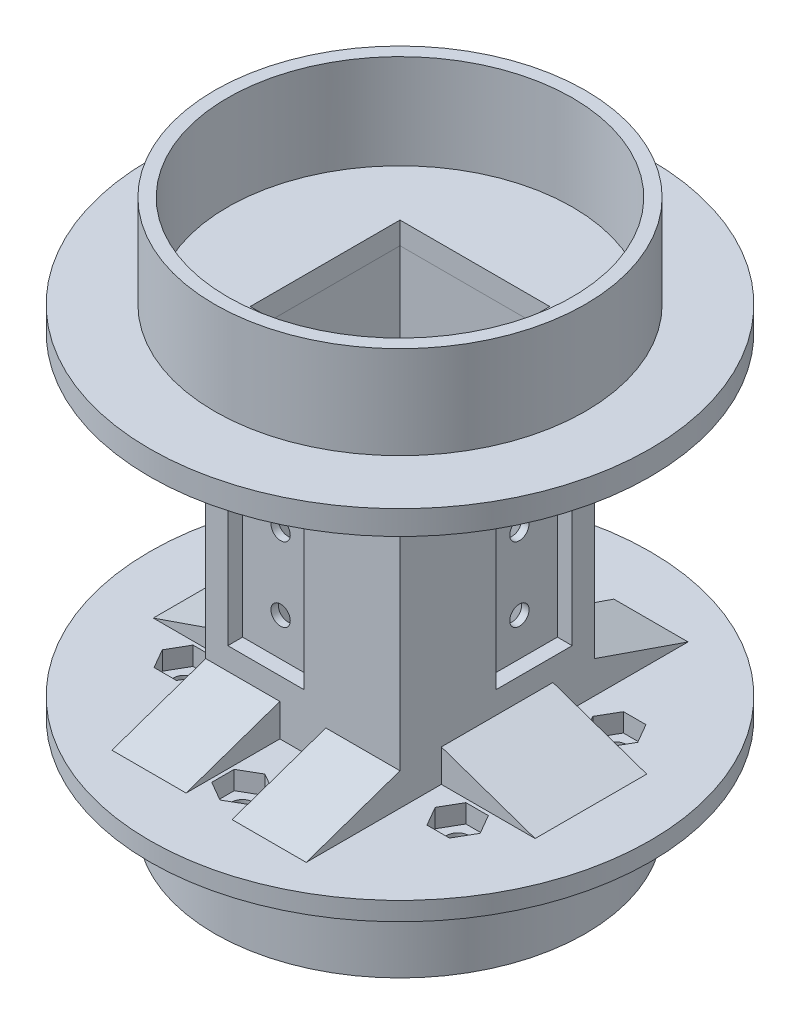
from build123d import *
from build123d.topology import SkipClean

# Parameters (mm, degrees)
SKETCH1_R               = 51.5
SKETCH1_R_2             = 46.5
BOSS_EXTRUDE1_DEPTH     = 41
BOSS_EXTRUDE2_START     = 5
SKETCH2_R               = 75
SKETCH2_R_2             = 46.5
BOSS_EXTRUDE2_DEPTH     = 5
SKETCH3_R               = 46.5
BOSS_EXTRUDE3_DEPTH     = 5
SKETCH4_W               = 40.4
SKETCH4_H               = 40.4
CUT_EXTRUDE1_DEPTH      = 6
SKETCH5_W               = 52.4
SKETCH5_H               = 52.4
SKETCH5_W_2             = 40.4
SKETCH5_H_2             = 40.4
BOSS_EXTRUDE4_DEPTH     = 80
SKETCH8_W               = 52.4
SKETCH8_H               = 52.4
BOSS_EXTRUDE5_DEPTH     = 5
CUT_EXTRUDE4_START      = -1
SKETCH9_R               = 75
SKETCH9_R_2             = 51.5
CUT_EXTRUDE4_DEPTH      = 1
BOSS_EXTRUDE6_START     = 1
SKETCH10_R              = 75
SKETCH10_W              = 52.4
SKETCH10_H              = 52.4
BOSS_EXTRUDE6_DEPTH     = 1
CUT_EXTRUDE5_DEPTH      = 169.5556288
CUT_EXTRUDE5_DEPTH_BACK = 13
SKETCH11_R              = 51.5
SKETCH11_R_2            = 46.5
SKETCH12_W              = 40.4
SKETCH12_H              = 40.4
CUT_EXTRUDE6_DEPTH      = 1
SKETCH13_W              = 52.4
SKETCH13_H              = 52.4
BOSS_EXTRUDE7_DEPTH     = 1
SKETCH6_W               = 20.5
SKETCH6_H               = 60.5
CUT_EXTRUDE2_DEPTH      = 4
SKETCH7_R               = 2.6
CUT_EXTRUDE3_DEPTH      = 2
SKETCH14_W              = 20.5
SKETCH14_H              = 60.5
CUT_EXTRUDE7_DEPTH      = 4
SKETCH15_R              = 2.6
CUT_EXTRUDE8_DEPTH      = 4
CIRPATTERN1_COUNT       = 2
CIRPATTERN2_COUNT       = 2
CUT_EXTRUDE9_START      = -14
SKETCH16_R              = 75
SKETCH16_R_2            = 67.5
CUT_EXTRUDE9_DEPTH      = 14
BOSS_EXTRUDE8_START     = 5
SKETCH17_R              = 67.5
BOSS_EXTRUDE8_DEPTH     = 5
SKETCH27_W              = 11
SKETCH27_H              = 4
SKETCH27_W_2            = 4
SKETCH27_H_2            = 11
CUT_EXTRUDE10_DEPTH     = 20
CUT_EXTRUDE11_START     = -29
SKETCH28_R              = 51.5
SKETCH28_R_2            = 50
CUT_EXTRUDE11_DEPTH     = 29
BOSS_EXTRUDE17_START    = 24
SKETCH29_R              = 50
SKETCH29_R_2            = 45
BOSS_EXTRUDE17_DEPTH    = 24
SKETCH30_W              = 11.5
SKETCH30_H              = 4.5
SKETCH30_W_2            = 11
SKETCH30_H_2            = 4
SKETCH30_W_3            = 4.5
SKETCH30_H_3            = 11.5
SKETCH30_W_4            = 4
SKETCH30_H_4            = 11
CUT_EXTRUDE12_DEPTH     = 10
SKETCH31_W              = 4.5
SKETCH31_H              = 11.5
SKETCH31_W_2            = 11.5
SKETCH31_H_2            = 4.5
CUT_EXTRUDE13_DEPTH     = 10
BOSS_EXTRUDE18_START    = 24
SKETCH33_R              = 45
SKETCH33_R_2            = 35
BOSS_EXTRUDE18_DEPTH    = 24
BOSS_EXTRUDE19_START    = 1.5
SKETCH34_R              = 50
SKETCH34_R_2            = 35
BOSS_EXTRUDE19_DEPTH    = 1.5
SKETCH35_R              = 2.95
CUT_EXTRUDE14_DEPTH     = 45
BOSS_EXTRUDE20_DEPTH    = 20
BOSS_EXTRUDE21_DEPTH    = 20
BOSS_EXTRUDE22_DEPTH    = 15.05
BOSS_EXTRUDE23_DEPTH    = 20
BOSS_EXTRUDE24_DEPTH    = 20
BOSS_EXTRUDE25_DEPTH    = 15.05
CUT_EXTRUDE15_DEPTH     = 5
CUT_EXTRUDE16_START     = -4
SKETCH42_R              = 50
SKETCH42_R_2            = 46.5
CUT_EXTRUDE16_DEPTH     = 4
CUT_EXTRUDE17_START     = -0.5
SKETCH43_R              = 67.5
SKETCH43_R_2            = 50
CUT_EXTRUDE17_DEPTH     = 0.5
SKETCH44_R              = 67.5
SKETCH44_R_2            = 50
BOSS_EXTRUDE26_DEPTH    = 2
SKETCH45_R              = 50
SKETCH45_R_2            = 46.5
BOSS_EXTRUDE27_DEPTH    = 1.5
SKETCH46_W              = 11.5
SKETCH46_H              = 2
SKETCH46_W_2            = 2
SKETCH46_H_2            = 11.5
CUT_EXTRUDE18_DEPTH     = 10
SPLIT1_SURFACE_1_BACK   = 241.954
SPLIT1_SURFACE_1_DEPTH  = 483.908
SPLIT1_SURFACE_2_BACK   = 241.954
SPLIT1_SURFACE_2_DEPTH  = 483.908


with BuildPart() as part:
    # Sketch1 → Boss-Extrude1 (new body)
    with BuildSketch(Plane(origin=(0, 0, 0), x_dir=(1, 0, 0), z_dir=(0, 1, 0))):
        with Locations(Location((0, 0, 0), (0, 0, 270))):
            Circle(SKETCH1_R)
        with Locations(Location((0, 0, 0), (0, 0, 270))):
            Circle(SKETCH1_R_2, mode=Mode.SUBTRACT)
    extrude(amount=BOSS_EXTRUDE1_DEPTH)

    # Sketch2 → Boss-Extrude2 (add)
    with SkipClean():  # the faces are left unmerged after this step: merging them gives an invalid solid
        with BuildSketch(Plane.XZ.offset(BOSS_EXTRUDE2_START)):
            with Locations(Location((0, 0, 0), (0, 0, 270))):
                Circle(SKETCH2_R)
            with Locations(Location((0, 0, 0), (0, 0, 270))):
                Circle(SKETCH2_R_2, mode=Mode.SUBTRACT)
        extrude(amount=-BOSS_EXTRUDE2_DEPTH)

    # Sketch3 → Boss-Extrude3 (add)
    with BuildSketch(Plane.XZ.offset(5)):
        with Locations(Location((0, 0, 0), (0, 0, 270))):
            Circle(SKETCH3_R)
    extrude(amount=-BOSS_EXTRUDE3_DEPTH)

    # Sketch4 → Cut-Extrude1 (cut)
    with BuildSketch(Plane(origin=(0, 0, 0), x_dir=(1, 0, 0), z_dir=(0, 1, 0))):
        Rectangle(SKETCH4_W, SKETCH4_H)
    extrude(amount=-CUT_EXTRUDE1_DEPTH, mode=Mode.SUBTRACT)

    # Sketch5 → Boss-Extrude4 (add)
    with BuildSketch(Plane.XZ.offset(5)):
        Rectangle(SKETCH5_W, SKETCH5_H)
        Rectangle(SKETCH5_W_2, SKETCH5_H_2, mode=Mode.SUBTRACT)
    extrude(amount=BOSS_EXTRUDE4_DEPTH)

    # Sketch8 → Boss-Extrude5 (add)
    with BuildSketch(Plane.XZ.offset(85)):
        Rectangle(SKETCH8_W, SKETCH8_H)
    extrude(amount=BOSS_EXTRUDE5_DEPTH)

    # Sketch9 → Cut-Extrude4 (cut)
    with BuildSketch(Plane(origin=(0, 0, 0), x_dir=(1, 0, 0), z_dir=(0, 1, 0)).offset(CUT_EXTRUDE4_START)):
        with Locations(Location((0, 0, 0), (0, 0, 270))):
            Circle(SKETCH9_R)
        with Locations(Location((0, 0, 0), (0, 0, 270))):
            Circle(SKETCH9_R_2, mode=Mode.SUBTRACT)
    extrude(amount=CUT_EXTRUDE4_DEPTH, mode=Mode.SUBTRACT)

    # Sketch10 → Boss-Extrude6 (add)
    with BuildSketch(Plane.XZ.offset(5).offset(BOSS_EXTRUDE6_START)):
        with Locations(Location((0, 0, 0), (0, 0, 90))):
            Circle(SKETCH10_R)
        Rectangle(SKETCH10_W, SKETCH10_H, mode=Mode.SUBTRACT)
    extrude(amount=-BOSS_EXTRUDE6_DEPTH)

    # Sketch11 → Cut-Extrude5 (cut, two sides: drawn at the far end of the back side and taken through both)
    with BuildSketch(Plane(origin=(0, 41, 0), x_dir=(1, 0, 0), z_dir=(0, 1, 0)).offset(-CUT_EXTRUDE5_DEPTH_BACK)):
        with Locations(Location((0, 0, 0), (0, 0, 270))):
            Circle(SKETCH11_R)
        with Locations(Location((0, 0, 0), (0, 0, 90))):
            Circle(SKETCH11_R_2, mode=Mode.SUBTRACT)
    extrude(amount=CUT_EXTRUDE5_DEPTH + CUT_EXTRUDE5_DEPTH_BACK, mode=Mode.SUBTRACT)

    # Sketch12 → Cut-Extrude6 (cut)
    with BuildSketch(Plane(origin=(0, -85, 0), x_dir=(1, 0, 0), z_dir=(0, 1, 0))):
        Rectangle(SKETCH12_W, SKETCH12_H)
    extrude(amount=-CUT_EXTRUDE6_DEPTH, mode=Mode.SUBTRACT)

    # Sketch13 → Boss-Extrude7 (add)
    with BuildSketch(Plane.XZ.offset(90)):
        Rectangle(SKETCH13_W, SKETCH13_H)
    extrude(amount=BOSS_EXTRUDE7_DEPTH)

    # Sketch6 → Cut-Extrude2 (cut)
    with BuildSketch(Plane.XY.offset(26.2)):
        with Locations((-10, -46)):
            Rectangle(SKETCH6_W, SKETCH6_H)
    cut_extrude2 = extrude(amount=-CUT_EXTRUDE2_DEPTH, mode=Mode.SUBTRACT)

    # Sketch7 → Cut-Extrude3 (cut)
    with BuildSketch(Plane.XY.offset(22.2)):
        with Locations((-10, -26)):
            Circle(SKETCH7_R)
        with Locations((-10, -46)):
            Circle(SKETCH7_R)
        with Locations((-10, -66)):
            Circle(SKETCH7_R)
    cut_extrude3 = extrude(amount=-CUT_EXTRUDE3_DEPTH, mode=Mode.SUBTRACT)

    # Sketch14 → Cut-Extrude7 (cut)
    with BuildSketch(Plane.ZY.offset(26.2)):
        with Locations((10, -46)):
            Rectangle(SKETCH14_W, SKETCH14_H)
    cut_extrude7 = extrude(amount=-CUT_EXTRUDE7_DEPTH, mode=Mode.SUBTRACT)

    # Sketch15 → Cut-Extrude8 (cut)
    with BuildSketch(Plane.ZY.offset(22.2)):
        with Locations((10, -26)):
            Circle(SKETCH15_R)
        with Locations((10, -46)):
            Circle(SKETCH15_R)
        with Locations((10, -66)):
            Circle(SKETCH15_R)
    cut_extrude8 = extrude(amount=-CUT_EXTRUDE8_DEPTH, mode=Mode.SUBTRACT)

    # CirPattern1: Cut-Extrude2, Cut-Extrude3 ×2 about axis
    cirpattern1_axis = Axis((0, 0, 0), (0, 1, 0))
    add([cut_extrude2.rotate(cirpattern1_axis, i * 360 / CIRPATTERN1_COUNT) for i in range(1, CIRPATTERN1_COUNT)], mode=Mode.SUBTRACT)
    add([cut_extrude3.rotate(cirpattern1_axis, i * 360 / CIRPATTERN1_COUNT) for i in range(1, CIRPATTERN1_COUNT)], mode=Mode.SUBTRACT)

    # CirPattern2: Cut-Extrude7, Cut-Extrude8 ×2 about axis
    cirpattern2_axis = Axis((0, 0, 0), (0, 1, 0))
    add([cut_extrude7.rotate(cirpattern2_axis, i * 360 / CIRPATTERN2_COUNT) for i in range(1, CIRPATTERN2_COUNT)], mode=Mode.SUBTRACT)
    add([cut_extrude8.rotate(cirpattern2_axis, i * 360 / CIRPATTERN2_COUNT) for i in range(1, CIRPATTERN2_COUNT)], mode=Mode.SUBTRACT)

    # Sketch16 → Cut-Extrude9 (cut)
    with BuildSketch(Plane(origin=(0, -1, 0), x_dir=(1, 0, 0), z_dir=(0, 1, 0)).offset(CUT_EXTRUDE9_START)):
        Circle(SKETCH16_R)
        with Locations(Location((0, 0, 0), (0, 0, 270))):
            Circle(SKETCH16_R_2, mode=Mode.SUBTRACT)
    extrude(amount=CUT_EXTRUDE9_DEPTH, mode=Mode.SUBTRACT)

    # Sketch17 → Boss-Extrude8 (add)
    with BuildSketch(Plane.XZ.offset(91).offset(BOSS_EXTRUDE8_START)):
        with Locations(Location((0, 0, 0), (0, 0, 90))):
            Circle(SKETCH17_R)
    extrude(amount=-BOSS_EXTRUDE8_DEPTH)

    # Sketch27 → Cut-Extrude10 (cut)
    with BuildSketch(Plane(origin=(0, -86, 0), x_dir=(1, 0, 0), z_dir=(0, 1, 0))):
        with Locations((10, 18.2)):
            Rectangle(SKETCH27_W, SKETCH27_H)
        with Locations((18.2, 10)):
            Rectangle(SKETCH27_W_2, SKETCH27_H_2)
        with Locations((-18.2, -10)):
            Rectangle(SKETCH27_W_2, SKETCH27_H_2)
        with Locations((-10, -18.2)):
            Rectangle(SKETCH27_W, SKETCH27_H)
    extrude(amount=-CUT_EXTRUDE10_DEPTH, mode=Mode.SUBTRACT)

    # Sketch28 → Cut-Extrude11 (cut)
    with BuildSketch(Plane(origin=(0, 28, 0), x_dir=(1, 0, 0), z_dir=(0, 1, 0)).offset(CUT_EXTRUDE11_START)):
        Circle(SKETCH28_R)
        with Locations(Location((0, 0, 0), (0, 0, 270))):
            Circle(SKETCH28_R_2, mode=Mode.SUBTRACT)
    extrude(amount=CUT_EXTRUDE11_DEPTH, mode=Mode.SUBTRACT)

    # Sketch29 → Boss-Extrude17 (add)
    with BuildSketch(Plane.XZ.offset(96).offset(BOSS_EXTRUDE17_START)):
        with Locations(Location((0, 0, 0), (0, 0, 90))):
            Circle(SKETCH29_R)
        with Locations(Location((0, 0, 0), (0, 0, 270))):
            Circle(SKETCH29_R_2, mode=Mode.SUBTRACT)
    extrude(amount=-BOSS_EXTRUDE17_DEPTH)

    # Sketch30 → Cut-Extrude12 (cut)
    # profile 1 of 4: a face of its own
    with BuildSketch(Plane.XZ.offset(96)):
        with Locations((-10, 18.2)):
            Rectangle(SKETCH30_W, SKETCH30_H)
        with Locations((-10, 18.2)):
            Rectangle(SKETCH30_W_2, SKETCH30_H_2, mode=Mode.SUBTRACT)
    # profile 2 of 4: a face of its own
    with BuildSketch(Plane.XZ.offset(96)):
        with Locations((-10, 18.2)):
            Rectangle(SKETCH30_W_2, SKETCH30_H_2)
    # profile 3 of 4: a face of its own
    with BuildSketch(Plane.XZ.offset(96)):
        with Locations((-18.2, 10)):
            Rectangle(SKETCH30_W_3, SKETCH30_H_3)
        with Locations((-18.2, 10)):
            Rectangle(SKETCH30_W_4, SKETCH30_H_4, mode=Mode.SUBTRACT)
    # profile 4 of 4: a face of its own
    with BuildSketch(Plane.XZ.offset(96)):
        with Locations((-18.2, 10)):
            Rectangle(SKETCH30_W_4, SKETCH30_H_4)
    extrude(amount=-CUT_EXTRUDE12_DEPTH, mode=Mode.SUBTRACT)

    # Sketch31 → Cut-Extrude13 (cut)
    with BuildSketch(Plane.XZ.offset(96)):
        with Locations((18.2, -10)):
            Rectangle(SKETCH31_W, SKETCH31_H)
        with Locations((10, -18.2)):
            Rectangle(SKETCH31_W_2, SKETCH31_H_2)
    extrude(amount=-CUT_EXTRUDE13_DEPTH, mode=Mode.SUBTRACT)

    # Sketch33 → Boss-Extrude18 (add)
    with BuildSketch(Plane.XZ.offset(96).offset(BOSS_EXTRUDE18_START)):
        Circle(SKETCH33_R)
        with Locations(Location((0, 0, 0), (0, 0, 270))):
            Circle(SKETCH33_R_2, mode=Mode.SUBTRACT)
    extrude(amount=-BOSS_EXTRUDE18_DEPTH)

    # Sketch34 → Boss-Extrude19 (add)
    with BuildSketch(Plane.XZ.offset(120).offset(BOSS_EXTRUDE19_START)):
        with Locations(Location((0, 0, 0), (0, 0, 90))):
            Circle(SKETCH34_R)
        with Locations(Location((0, 0, 0), (0, 0, 270))):
            Circle(SKETCH34_R_2, mode=Mode.SUBTRACT)
    extrude(amount=-BOSS_EXTRUDE19_DEPTH)

    # Sketch35 → Cut-Extrude14 (cut)
    with BuildSketch(Plane.XZ.offset(121.5)):
        with Locations(Location((0, 42.5, 0), (0, 0, 270))):
            Circle(SKETCH35_R)
        with Locations(Location((36.806079661, 21.25, 0), (0, 0, 270))):
            Circle(SKETCH35_R)
        with Locations(Location((36.806079661, -21.25, 0), (0, 0, 270))):
            Circle(SKETCH35_R)
        with Locations(Location((0, -42.5, 0), (0, 0, 270))):
            Circle(SKETCH35_R)
        with Locations(Location((-36.806079661, -21.25, 0), (0, 0, 270))):
            Circle(SKETCH35_R)
        with Locations(Location((-36.806079661, 21.25, 0), (0, 0, 270))):
            Circle(SKETCH35_R)
    extrude(amount=-CUT_EXTRUDE14_DEPTH, mode=Mode.SUBTRACT)

    # Sketch25 → Boss-Extrude20 (add)
    with BuildSketch(Plane.ZY.offset(26.2)):
        Polygon((-26.2, -82.25), (-51.5, -91), (-26.2, -91), align=None)
    extrude(amount=-BOSS_EXTRUDE20_DEPTH)

    # Sketch37 → Boss-Extrude21 (add)
    with BuildSketch(Plane(origin=(26.2, 0, 0), x_dir=(0, 0, -1), z_dir=(1, 0, 0))):
        Polygon((26.2, -82.25), (26.2, -91), (51.5, -91), align=None)
    extrude(amount=-BOSS_EXTRUDE21_DEPTH)

    # Sketch39 → Boss-Extrude22 (add, symmetric)
    with BuildSketch(Plane(origin=(0, 0, 0), x_dir=(-1, 0, 0), z_dir=(0, 0, -1))):
        Polygon((-51.5, -91), (-26.2, -91), (-26.2, -82.25), align=None)
    extrude(amount=BOSS_EXTRUDE22_DEPTH, both=True)

    # Sketch23 → Boss-Extrude23 (add)
    with BuildSketch(Plane(origin=(26.2, 0, 0), x_dir=(0, 0, -1), z_dir=(1, 0, 0))):
        Polygon((-51.5, -91), (-26.2, -82.25), (-26.2, -91), align=None)
    extrude(amount=-BOSS_EXTRUDE23_DEPTH)

    # Sketch40 → Boss-Extrude24 (add)
    with BuildSketch(Plane.ZY.offset(26.2)):
        Polygon((26.2, -91), (51.5, -91), (26.2, -82.25), align=None)
    extrude(amount=-BOSS_EXTRUDE24_DEPTH)

    # Sketch41 → Boss-Extrude25 (add, symmetric)
    with BuildSketch(Plane.XY):
        Polygon((-51.5, -91), (-26.2, -91), (-26.2, -82.25), align=None)
    extrude(amount=BOSS_EXTRUDE25_DEPTH, both=True)

    # Sketch38 → Cut-Extrude15 (cut)
    with BuildSketch(Plane(origin=(0, -91, 0), x_dir=(1, 0, 0), z_dir=(0, 1, 0))):
        Polygon((39.837168574, -16), (33.774990748, -16), (30.743901834, -21.25), (33.774990748, -26.5), (39.837168574, -26.5), (42.868257487, -21.25), align=None)
        Polygon((39.837168574, 26.5), (33.774990748, 26.5), (30.743901834, 21.25), (33.774990748, 16), (39.837168574, 16), (42.868257487, 21.25), align=None)
        Polygon((5.25, -45.531088913), (5.25, -39.468911087), (0, -36.437822174), (-5.25, -39.468911087), (-5.25, -45.531088913), (0, -48.562177826), align=None)
        Polygon((-39.837168574, -26.5), (-33.774990748, -26.5), (-30.743901834, -21.25), (-33.774990748, -16), (-39.837168574, -16), (-42.868257487, -21.25), align=None)
        Polygon((-39.837168574, 16), (-33.774990748, 16), (-30.743901834, 21.25), (-33.774990748, 26.5), (-39.837168574, 26.5), (-42.868257487, 21.25), align=None)
        Polygon((0, 48.562177826), (-5.25, 45.531088913), (-5.25, 39.468911087), (0, 36.437822174), (5.25, 39.468911087), (5.25, 45.531088913), align=None)
    extrude(amount=-CUT_EXTRUDE15_DEPTH, mode=Mode.SUBTRACT)

    # Sketch42 → Cut-Extrude16 (cut)
    with BuildSketch(Plane(origin=(0, 28, 0), x_dir=(1, 0, 0), z_dir=(0, 1, 0)).offset(CUT_EXTRUDE16_START)):
        with Locations(Location((0, 0, 0), (0, 0, 270))):
            Circle(SKETCH42_R)
        with Locations(Location((0, 0, 0), (0, 0, 90))):
            Circle(SKETCH42_R_2, mode=Mode.SUBTRACT)
    extrude(amount=CUT_EXTRUDE16_DEPTH, mode=Mode.SUBTRACT)

    # Sketch43 → Cut-Extrude17 (cut)
    with BuildSketch(Plane(origin=(0, -1, 0), x_dir=(1, 0, 0), z_dir=(0, 1, 0)).offset(CUT_EXTRUDE17_START)):
        with Locations(Location((0, 0, 0), (0, 0, 270))):
            Circle(SKETCH43_R)
        with Locations(Location((0, 0, 0), (0, 0, 270))):
            Circle(SKETCH43_R_2, mode=Mode.SUBTRACT)
    extrude(amount=CUT_EXTRUDE17_DEPTH, mode=Mode.SUBTRACT)

    # Sketch44 → Boss-Extrude26 (add)
    with BuildSketch(Plane(origin=(0, -1.5, 0), x_dir=(1, 0, 0), z_dir=(0, 1, 0))):
        with Locations(Location((0, 0, 0), (0, 0, 270))):
            Circle(SKETCH44_R)
        with Locations(Location((0, 0, 0), (0, 0, 270))):
            Circle(SKETCH44_R_2, mode=Mode.SUBTRACT)
    extrude(amount=BOSS_EXTRUDE26_DEPTH)

    # Sketch45 → Boss-Extrude27 (add)
    with BuildSketch(Plane(origin=(0, 24, 0), x_dir=(1, 0, 0), z_dir=(0, 1, 0))):
        with Locations(Location((0, 0, 0), (0, 0, 270))):
            Circle(SKETCH45_R)
        with Locations(Location((0, 0, 0), (0, 0, 90))):
            Circle(SKETCH45_R_2, mode=Mode.SUBTRACT)
    extrude(amount=BOSS_EXTRUDE27_DEPTH)

    # Sketch46 → Cut-Extrude18 (cut)
    with BuildSketch(Plane.XZ.offset(96)):
        with Locations((-10, 14.95)):
            Rectangle(SKETCH46_W, SKETCH46_H)
        with Locations((-14.95, 10)):
            Rectangle(SKETCH46_W_2, SKETCH46_H_2)
        with Locations((10, -14.95)):
            Rectangle(SKETCH46_W, SKETCH46_H)
        with Locations((14.95, -10)):
            Rectangle(SKETCH46_W_2, SKETCH46_H_2)
    extrude(amount=-CUT_EXTRUDE18_DEPTH, mode=Mode.SUBTRACT)


with BuildPart() as body_2:
    # Split1: the piece behind the surface
    add(part.part)
    # Split1 surface: a surface, the sketch's curves swept straight by 483.908 mm
    with BuildLine(Plane.XY.offset(-SPLIT1_SURFACE_1_BACK), mode=Mode.PRIVATE) as split1_surface_1_path:
        Line((26.2, -6), (-26.2, -6))
    split1_surface_1 = Shell.extrude(split1_surface_1_path.wire(), (0 * SPLIT1_SURFACE_1_DEPTH, 0 * SPLIT1_SURFACE_1_DEPTH, 1 * SPLIT1_SURFACE_1_DEPTH))
    split(bisect_by=split1_surface_1, keep=Keep.BOTTOM)


with BuildPart() as part_1:
    add(part.part)

    # Split1: split by a surface, the side it looks to stays
    # Split1 surface: a surface, the sketch's curves swept straight by 483.908 mm
    with BuildLine(Plane.XY.offset(-SPLIT1_SURFACE_2_BACK), mode=Mode.PRIVATE) as split1_surface_2_path:
        Line((26.2, -6), (-26.2, -6))
    split1_surface_2 = Shell.extrude(split1_surface_2_path.wire(), (0 * SPLIT1_SURFACE_2_DEPTH, 0 * SPLIT1_SURFACE_2_DEPTH, 1 * SPLIT1_SURFACE_2_DEPTH))
    split(bisect_by=split1_surface_2, keep=Keep.TOP)


solid = Compound([body_2.part, part_1.part])
